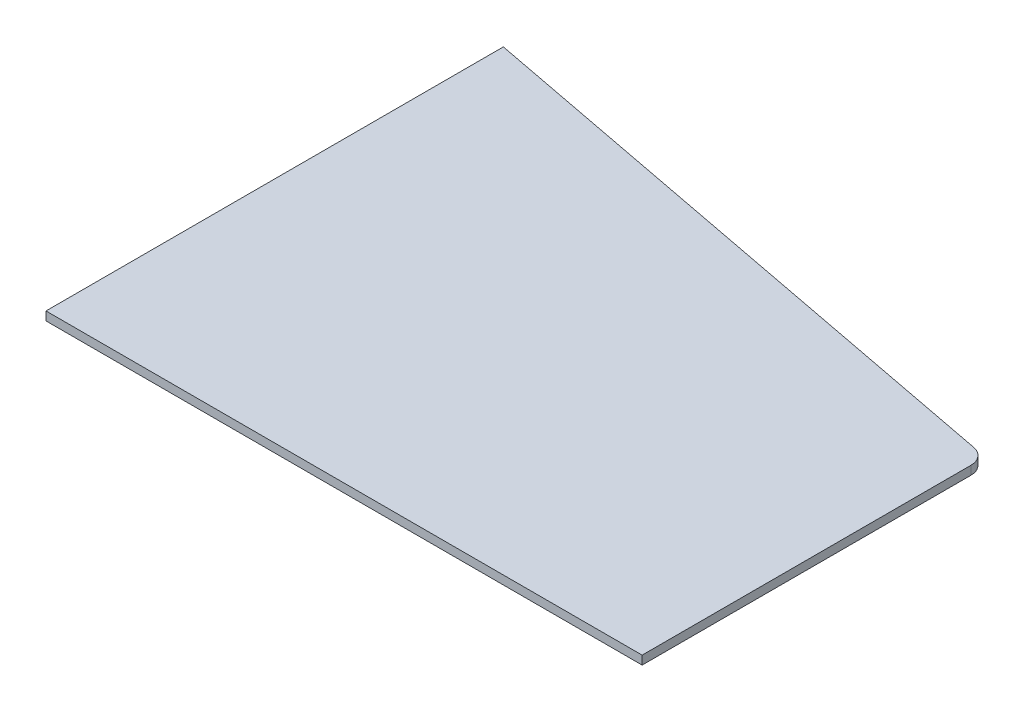
from build123d import *

# Parameters (mm, degrees)
BOSS_EXTRUDE1_DEPTH = 6.35


with BuildPart() as part:
    # Sketch1 → Boss-Extrude1 (new body)
    with BuildSketch(Plane(origin=(0, 0, 0), x_dir=(1, 0, 0), z_dir=(0, 1, 0))):
        with BuildLine():
            Line((0, 0), (437.02224, 0))
            Line((437.02224, 0), (437.02224, 240.964350344))
            ThreePointArc((437.02224, 240.964350344), (434.111809399, 249.054735438), (426.714471342, 253.437009611))
            Line((426.714471342, 253.437009611), (0, 335.28))
            Line((0, 335.28), (0, 0))
        make_face()
    extrude(amount=BOSS_EXTRUDE1_DEPTH)


solid = part.part
